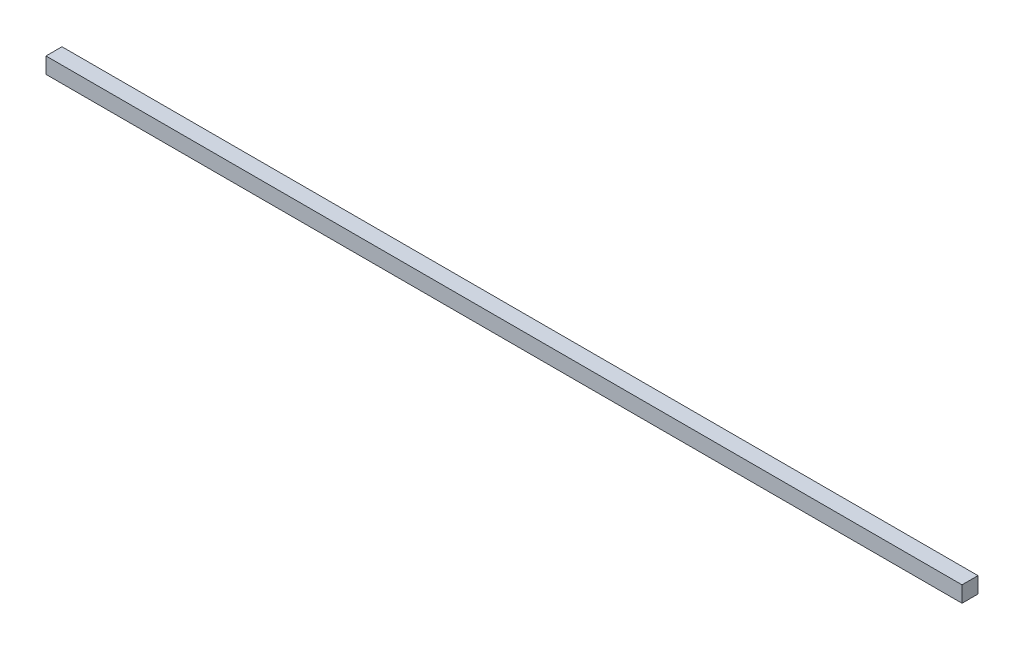
from build123d import *

# Parameters (mm, degrees)
SKETCH1_W           = 20
SKETCH1_H           = 20
BOSS_EXTRUDE1_DEPTH = 573.4


with BuildPart() as part:
    # Sketch1 → Boss-Extrude1 (new, symmetric)
    with BuildSketch(Plane(origin=(0, 0, 0), x_dir=(0, 0, -1), z_dir=(1, 0, 0))):
        with Locations((14.642857143, -30.892857143)):
            Rectangle(SKETCH1_W, SKETCH1_H)
    extrude(amount=BOSS_EXTRUDE1_DEPTH, both=True)


solid = part.part
